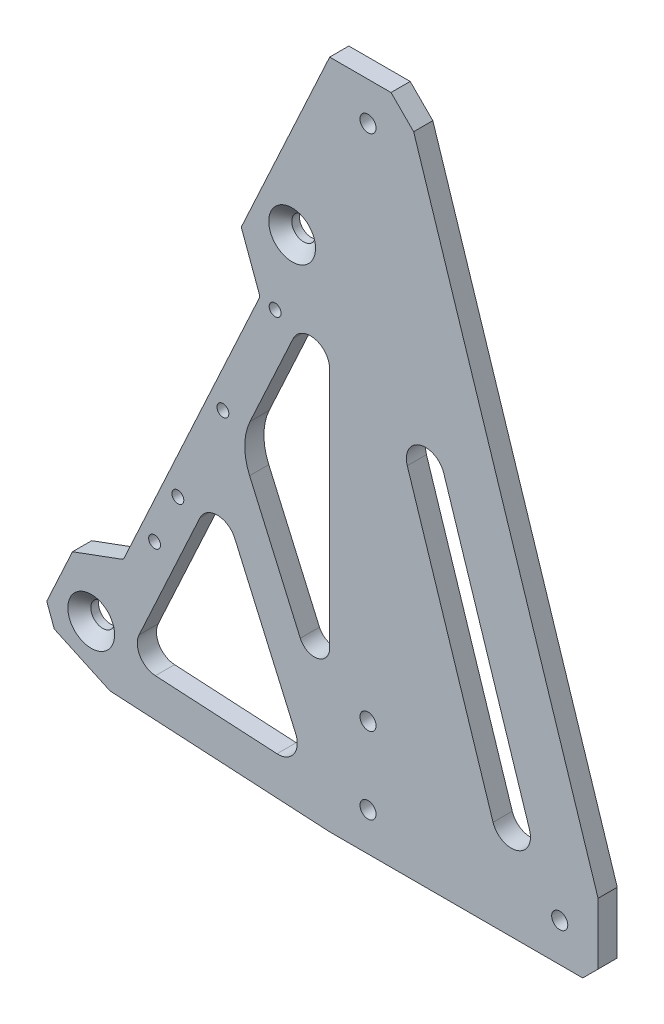
from build123d import *
from OCP.BRepFilletAPI import BRepFilletAPI_MakeChamfer

# Parameters (mm, degrees)
SKETCH_1_R          = 2.1
EXTRUDE_1_DEPTH     = 2.5
CUT_EXTRUDE_1_DEPTH = 95.372930441
EXTRUDE_2_DEPTH     = 5
CUT_EXTRUDE_2_DEPTH = 142.00635371
FILLET_1_R          = 5
FILLET_2_R          = 4
FILLET_3_R          = 15
CHAMFER_1_SIZE      = 4
CHAMFER_1_SIZE2     = 6.20437999
CHAMFER_2_SIZE      = 2
SKETCH_6_R          = 3.1
CUT_EXTRUDE_3_DEPTH = 140.696602049
CUT_EXTRUDE_4_DEPTH = 140.696602049
SKETCH_8_R          = 1.55
CUT_EXTRUDE_5_DEPTH = 140.696602049
FILLET_4_R          = 1
CHAMFER_3_SIZE      = 3


with BuildPart() as part:
    # 草图1 → 凸台-拉伸1 (new, symmetric)
    with BuildSketch(Plane.XY):
        Polygon((-35, 87.5), (-35, -87.5), (35, -87.5), (35, -67.5), (-15, 87.5), align=None)
        with Locations((-25, -77.5)):
            Circle(SKETCH_1_R, mode=Mode.SUBTRACT)
        with Locations((25, -77.5)):
            Circle(SKETCH_1_R, mode=Mode.SUBTRACT)
        with Locations((-25, 77.5)):
            Circle(SKETCH_1_R, mode=Mode.SUBTRACT)
        with Locations((-25, -57.5)):
            Circle(SKETCH_1_R, mode=Mode.SUBTRACT)
    extrude(amount=EXTRUDE_1_DEPTH, both=True)

    # 草图2 → 切除-拉伸1 (cut, through all)
    with BuildSketch(Plane(origin=(0, 0, -2.5), x_dir=(-1, 0, 0), z_dir=(0, 0, -1))):
        with BuildLine():
            Line((-17.130804412, -60.9649861), (5.241456911, 8.389024))
            ThreePointArc((5.241456911, 8.389024), (11.5350139, 11.612553189), (14.758543089, 5.318996201))
            Line((14.758543089, 5.318996201), (-7.613718234, -64.0350139))
            ThreePointArc((-7.613718234, -64.0350139), (-13.907275222, -67.258543089), (-17.130804412, -60.9649861))
        make_face()
    extrude(amount=-CUT_EXTRUDE_1_DEPTH, mode=Mode.SUBTRACT)

    # 草图3 → 凸台-拉伸2 (add)
    with BuildSketch(Plane(origin=(0, 0, -2.5), x_dir=(-1, 0, 0), z_dir=(0, 0, -1))):
        Polygon((35, -87.5), (92.302946454, -84.303295451), (110.460589291, -75.918785529), (35, 87.5), align=None)
    extrude(amount=-EXTRUDE_2_DEPTH)

    # 草图5 → 切除-拉伸2 (cut, through all)
    with BuildSketch(Plane(origin=(0, 0, -2.5), x_dir=(-1, 0, 0), z_dir=(0, 0, -1))):
        Polygon((35, 39.792977913), (58.598142626, -11.311576727), (35, -65.049025296), align=None)
        Polygon((87.794289034, -74.539267276), (40.598003783, -77.172161204), (64.196146409, -23.434712635), align=None)
    extrude(amount=-CUT_EXTRUDE_2_DEPTH, mode=Mode.SUBTRACT)

    # 圆角1
    fillet_1_edges = [part.edges().sort_by_distance(p)[0] for p in [
        (-64.196146409, -23.434712635, 0),
        (-87.794289034, -74.539267276, 0),
        (-40.598003783, -77.172161204, 0),
        (-35, 39.792977913, 0),
    ]]
    fillet(fillet_1_edges, radius=FILLET_1_R)

    # 圆角2
    fillet_2_edges = [part.edges().sort_by_distance(p)[0] for p in [
        (-35, -65.049025296, 0),
    ]]
    fillet(fillet_2_edges, radius=FILLET_2_R)

    # 圆角3
    fillet_3_edges = [part.edges().sort_by_distance(p)[0] for p in [
        (-58.598142626, -11.311576727, 0),
    ]]
    fillet(fillet_3_edges, radius=FILLET_3_R)

    # 倒角1: one chamfer whose edges measure the first distance from different faces: ONE call of the kernel's chamfer builder (chamfer() names one face for all edges)
    chamfer_1_edges_1 = [part.edges().sort_by_distance(p)[0] for p in [
        (-110.460589291, -75.918785529, 0),
        (35, -87.5, 0),
    ]]
    chamfer_1_edges_2 = [part.edges().sort_by_distance(p)[0] for p in [
        (-15, 87.5, 0),
    ]]
    chamfer_1_side_2 = [part.faces().sort_by_distance(p)[0] for p in [
        (-25, 87.5, 0),
    ]]
    chamfer_1 = BRepFilletAPI_MakeChamfer(part.part.solid().wrapped)
    for e in chamfer_1_edges_1:
        chamfer_1.Add(CHAMFER_1_SIZE, e.wrapped)
    for e in chamfer_1_edges_2:
        chamfer_1.Add(CHAMFER_1_SIZE, CHAMFER_1_SIZE2, e.wrapped, chamfer_1_side_2[0].wrapped)  # the first distance lies on this face
    add(Compound.cast(chamfer_1.Shape()), mode=Mode.REPLACE)

    # 倒角2
    chamfer_2_edges = [part.edges().sort_by_distance(p)[0] for p in [
        (22.9, -77.5, -2.5),
        (-27.1, -77.5, -2.5),
        (-27.1, 77.5, -2.5),
        (-27.1, -57.5, -2.5),
    ]]
    chamfer(chamfer_2_edges, length=CHAMFER_2_SIZE)

    # 草图6 → 切除-拉伸3 (cut, through all)
    with BuildSketch(Plane(origin=(0, 0, -2.5), x_dir=(-1, 0, 0), z_dir=(0, 0, -1))):
        with Locations((97.189512912, -71.032219072)):
            Circle(SKETCH_6_R)
        with Locations((44.786325904, 42.453048657)):
            Circle(SKETCH_6_R)
    extrude(amount=-CUT_EXTRUDE_3_DEPTH, mode=Mode.SUBTRACT)

    # 草图7 → 切除-拉伸4 (cut, through all)
    with BuildSketch(Plane.XY.offset(2.5)):
        Polygon((-58.057402283, 37.566482199), (-53.170835826, 24.29540582), (-88.805002991, -52.874576235), (-102.07607937, -57.761142693), align=None)
    extrude(amount=-CUT_EXTRUDE_4_DEPTH, mode=Mode.SUBTRACT)

    # 草图8 → 切除-拉伸5 (cut, through all)
    with BuildSketch(Plane.XY.offset(2.5)):
        with Locations((-49.224888136, 23.299415443)):
            Circle(SKETCH_8_R)
        with Locations((-62.849716758, -6.206754167)):
            Circle(SKETCH_8_R)
        with Locations((-74.588030648, -31.627454138)):
            Circle(SKETCH_8_R)
        with Locations((-80.666800341, -44.791745195)):
            Circle(SKETCH_8_R)
    extrude(amount=-CUT_EXTRUDE_5_DEPTH, mode=Mode.SUBTRACT)

    # 圆角4
    fillet_4_edges = [part.edges().sort_by_distance(p)[0] for p in [
        (-53.170835826, 24.29540582, 0),
        (-88.805002991, -52.874576235, 0),
    ]]
    fillet(fillet_4_edges, radius=FILLET_4_R)

    # 倒角3
    chamfer_3_edges = [part.edges().sort_by_distance(p)[0] for p in [
        (-94.089512912, -71.032219072, 2.5),
        (-41.686325904, 42.453048657, 2.5),
    ]]
    chamfer(chamfer_3_edges, length=CHAMFER_3_SIZE)


solid = part.part
